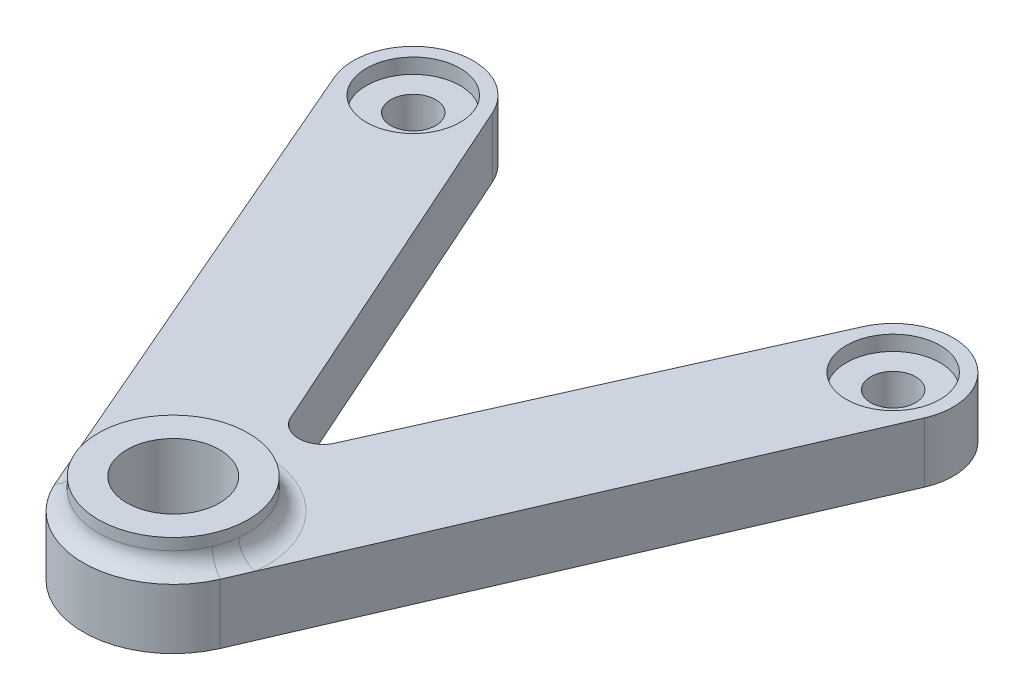
from build123d import *

# Parameters (mm, degrees)
SKETCH1_R                            = 7.9375
BOSS_EXTRUDE1_DEPTH                  = 6.35
F_3_16_0_1875_DIAMETER_HOLE1_D       = 4.7625
SKETCH1_3_R                          = 7.9375
BOSS_EXTRUDE2_DEPTH                  = 9.525
W_0_386_DIAMETER_HOLE1_D             = 9.8044
FILLET1_R                            = 2
F_25_64_0_39063_DIAMETER_HOLE1_D     = 9.922002
F_25_64_0_39063_DIAMETER_HOLE1_DEPTH = 1.5875


with BuildPart() as part:
    # Sketch1 → Boss-Extrude1 (new body)
    with BuildSketch(Plane(origin=(0, 0, 0), x_dir=(1, 0, 0), z_dir=(0, 1, 0))):
        with BuildLine():
            ThreePointArc((2.26024053, 17.840513709), (0, 16.529128421), (-2.26024053, 17.840513709))
            Line((-2.26024053, 17.840513709), (-19.602540008, 56.648386542))
            ThreePointArc((-19.602540008, 56.648386542), (-27.954355314, 59.871226792), (-31.229481324, 51.539776269))
            Line((-31.229481324, 51.539776269), (-8.744221986, -0.519156562))
            ThreePointArc((-8.744221986, -0.519156562), (0, -6.267358068), (8.744221986, -0.519156562))
            Line((8.744221986, -0.519156562), (31.229481324, 51.539776269))
            ThreePointArc((31.229481324, 51.539776269), (27.954355314, 59.871226792), (19.602540008, 56.648386542))
            Line((19.602540008, 56.648386542), (2.26024053, 17.840513709))
        make_face()
        with Locations(Location((0, 3.257641932, 0), (0, 0, 270))):
            Circle(SKETCH1_R, mode=Mode.SUBTRACT)
    extrude(amount=BOSS_EXTRUDE1_DEPTH)

    # 3/16 (0.1875) Diameter Hole1 (through all)
    with Locations(Plane(origin=(0, 6.35, 0), x_dir=(1, 0, 0), z_dir=(0, 1, 0))):
        with Locations((-25.4, 54.057641932), (25.4, 54.057641932)):
            Hole(F_3_16_0_1875_DIAMETER_HOLE1_D / 2)

    # Sketch1<3> → Boss-Extrude2 (add)
    with BuildSketch(Plane(origin=(0, 0, 0), x_dir=(1, 0, 0), z_dir=(0, 1, 0))):
        with Locations(Location((0, 3.257641932, 0), (0, 0, 90))):
            Circle(SKETCH1_3_R)
    extrude(amount=BOSS_EXTRUDE2_DEPTH)

    # W (0.386) Diameter Hole1 (through all)
    with Locations(Plane(origin=(0, 9.525, 0), x_dir=(1, 0, 0), z_dir=(0, 1, 0))):
        with Locations((0, 3.257641932)):
            Hole(W_0_386_DIAMETER_HOLE1_D / 2)

    # Fillet1
    fillet1_edges = [part.edges().sort_by_distance(p)[0] for p in [
        (0, 6.35, 4.679858068),
    ]]
    fillet(fillet1_edges, radius=FILLET1_R)

    # 25/64 (0.39063) Diameter Hole1
    with Locations(Plane(origin=(0, 6.35, 0), x_dir=(1, 0, 0), z_dir=(0, 1, 0))):
        with Locations((-25.4, 54.057641932), (25.4, 54.057641932)):
            Hole(F_25_64_0_39063_DIAMETER_HOLE1_D / 2, depth=F_25_64_0_39063_DIAMETER_HOLE1_DEPTH)


solid = part.part
